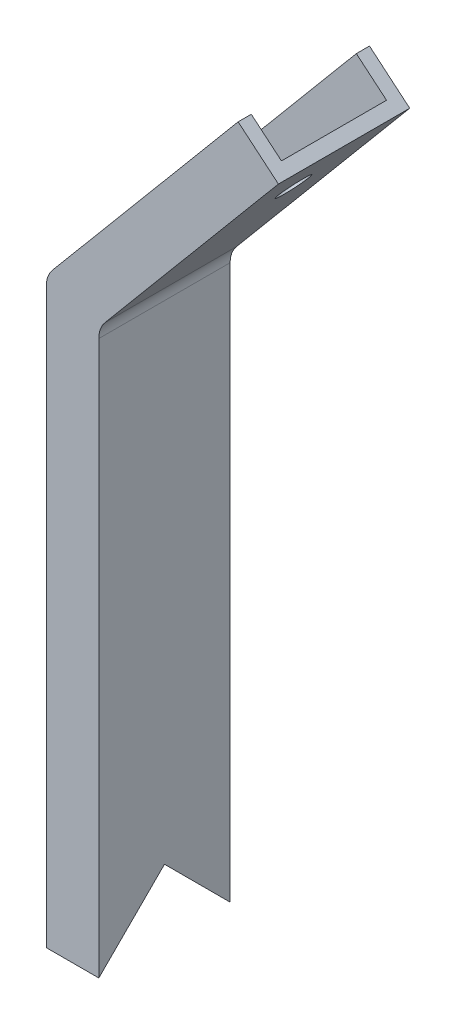
from build123d import *

# Parameters (mm, degrees)
BOSS_EXTRUDE1_DEPTH = 50
CUT_EXTRUDE1_REACH  = 338.776
SKETCH2_W           = 15
SKETCH2_H           = 40
CUT_EXTRUDE2_REACH  = 312.586
SKETCH3_W           = 15
SKETCH3_H           = 40
FILLET1_R           = 10
CUT_EXTRUDE3_REACH  = 210.165
CUT_EXTRUDE8_REACH  = 220.751
SKETCH7_R           = 6
CUT_EXTRUDE9_START  = -20
CUT_EXTRUDE9_DEPTH  = 20


with BuildPart() as part:
    # Sketch1 → Boss-Extrude1 (new body)
    with BuildSketch(Plane.XY):
        Polygon((10, -141.968058968), (10, 87.392238689), (78.367081497, 168.868953678), (63.046192634, 181.724705872), (-10, 94.671643375), (-10, -141.968058968), align=None)
    extrude(amount=BOSS_EXTRUDE1_DEPTH)

    # Cut-Extrude1: up to this plane
    cut_extrude1_end = Plane(origin=(-10, 94.671643375, 50), z_dir=(0.7660444431189772, -0.6427876096865403, 0))
    # Sketch2 → Cut-Extrude1 (cut, up to the surface)
    with BuildSketch(Plane.XZ.offset(141.968058968), mode=Mode.PRIVATE) as cut_extrude1_sk1:
        with Locations((-2.5, 25)):
            Rectangle(SKETCH2_W, SKETCH2_H)
    cut_extrude1_tool1 = split(extrude(cut_extrude1_sk1.sketch, amount=-CUT_EXTRUDE1_REACH, mode=Mode.PRIVATE), bisect_by=cut_extrude1_end, keep=Keep.BOTH, mode=Mode.PRIVATE)
    add(cut_extrude1_tool1.solids().sort_by_distance((-2.5, -141.968059, 25))[0], mode=Mode.SUBTRACT)

    # Cut-Extrude2: up to this plane
    cut_extrude2_end = Plane(origin=(5, 181.726705872, 45), z_dir=(-1, 0, 0))
    # Sketch3 → Cut-Extrude2 (cut, up to the surface)
    with BuildSketch(Plane(origin=(115.531117716, 137.684624594, 0), x_dir=(0.766044443118977, -0.6427876096865407, 0), z_dir=(0.6427876096865407, 0.766044443118977, 0)), mode=Mode.PRIVATE) as cut_extrude2_sk1:
        with Locations((-61.014203781, -25)):
            Rectangle(SKETCH3_W, SKETCH3_H)
    cut_extrude2_tool1 = split(extrude(cut_extrude2_sk1.sketch, amount=-CUT_EXTRUDE2_REACH, mode=Mode.PRIVATE), bisect_by=cut_extrude2_end, keep=Keep.BOTH, mode=Mode.PRIVATE)
    add(cut_extrude2_tool1.solids().sort_by_distance((68.791526, 176.903799, 25))[0], mode=Mode.SUBTRACT)

    # Fillet1
    fillet1_edges = [part.edges().sort_by_distance(p)[0] for p in [
        (-10, 94.671643375, 47.5),
        (10, 87.392238689, 25),
        (-10, 94.671643375, 2.5),
        (5, 89.212089861, 25),
    ]]
    fillet(fillet1_edges, radius=FILLET1_R)

    # Sketch4 → Cut-Extrude3 (cut, up to next)
    with BuildSketch(Plane.ZY.offset(10), mode=Mode.PRIVATE) as cut_extrude3_sk1:
        Polygon((0, -141.968058968), (25, -102.081750499), (50, -141.968058968), align=None)
    cut_extrude3_tool1 = extrude(cut_extrude3_sk1.sketch, amount=-CUT_EXTRUDE3_REACH, mode=Mode.PRIVATE) & part.part
    add(cut_extrude3_tool1.solids().sort_by_distance((-10, -128.672623, 25))[0], mode=Mode.SUBTRACT)

    # Sketch7 → Cut-Extrude8 (cut, up to next)
    with BuildSketch(Plane(origin=(-40.994258434, 34.398267133, 0), x_dir=(0, 0, 1), z_dir=(-0.766044443118977, 0.6427876096865406, 0)), mode=Mode.PRIVATE) as cut_extrude8_sk1:
        with Locations(Location((25, 149.734512574, 0), (0, 0, 270))):
            Circle(SKETCH7_R)
    cut_extrude8_tool1 = extrude(cut_extrude8_sk1.sketch, amount=-CUT_EXTRUDE8_REACH, mode=Mode.PRIVATE) & part.part
    add(cut_extrude8_tool1.solids().sort_by_distance((55.253231, 149.101558, 25))[0], mode=Mode.SUBTRACT)

    # Sketch10 → Cut-Extrude9 (cut)
    with BuildSketch(Plane.ZY.offset(10).offset(CUT_EXTRUDE9_START)):
        Polygon((50, -127.0817505), (25, -102.081750499), (0, -127.081750499), (0, -141.968058968), (50, -141.968058968), align=None)
    extrude(amount=CUT_EXTRUDE9_DEPTH, mode=Mode.SUBTRACT)


solid = part.part
